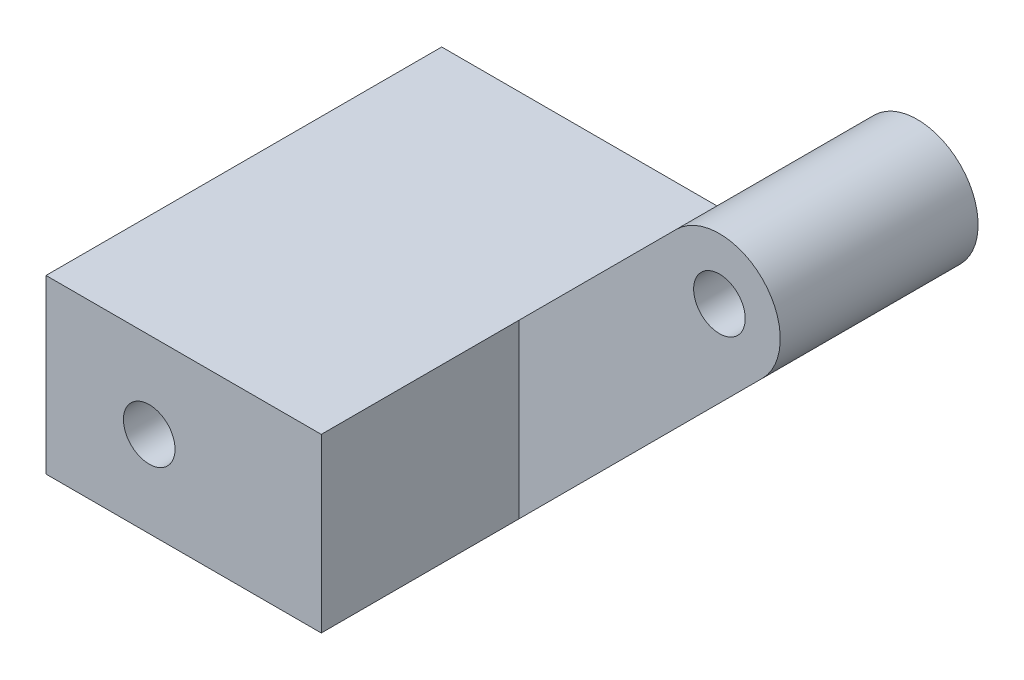
from build123d import *

# Parameters (mm, degrees)
SKETCH_1_R          = 1.5
EXTRUDE_2_DEPTH     = 23
SKETCH_2_W          = 17.071500421
SKETCH_2_H          = 21.570260429
CUT_EXTRUDE_1_DEPTH = 11.5


with BuildPart() as part:
    # 草图1 → 凸台-拉伸2 (new body)
    with BuildSketch(Plane.XY):
        with BuildLine():
            Line((16, 0), (30.142135624, 14.142135624))
            ThreePointArc((30.142135624, 14.142135624), (30.142135624, 19.142135624), (25.142135624, 19.142135624))
            Line((25.142135624, 19.142135624), (16, 10))
            Line((16, 10), (0, 10))
            Line((0, 10), (0, 0))
            Line((0, 0), (16, 0))
        make_face()
        with Locations((27.642135624, 16.642135624)):
            Circle(SKETCH_1_R, mode=Mode.SUBTRACT)
        with Locations((6, 5)):
            Circle(SKETCH_1_R, mode=Mode.SUBTRACT)
    extrude(amount=EXTRUDE_2_DEPTH)

    # 草图2 → 切除-拉伸1 (cut)
    with BuildSketch(Plane.XY.offset(23)):
        with Locations((24.535750211, 10.785130215)):
            Rectangle(SKETCH_2_W, SKETCH_2_H)
    extrude(amount=-CUT_EXTRUDE_1_DEPTH, mode=Mode.SUBTRACT)


solid = part.part
